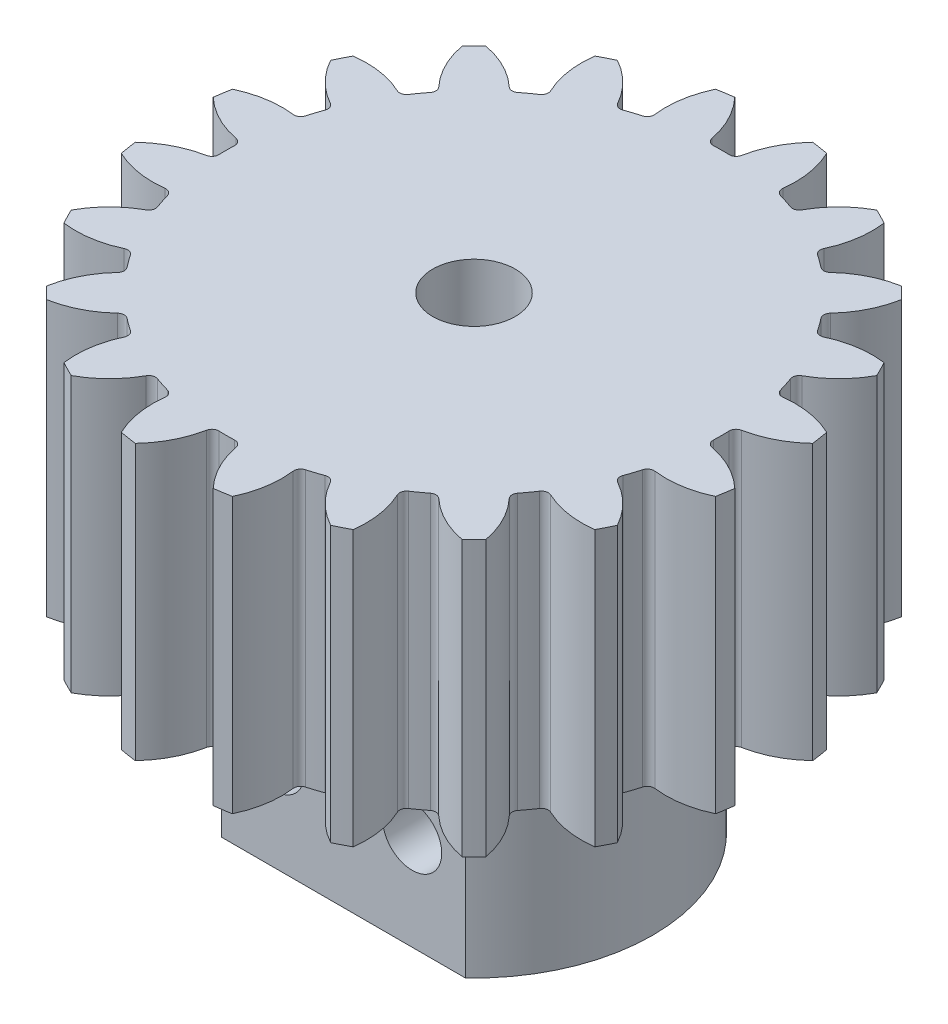
from build123d import *

# Parameters (mm, degrees)
SKETCH_1_R               = 22
EXTRUDE_1_DEPTH          = 20
CUT_EXTRUDE_1_DEPTH      = 37.986484018
PATTERN_CIRCULAR_1_COUNT = 20
SKETCH_3_R               = 13
EXTRUDE_2_DEPTH          = 14
CUT_EXTRUDE_START        = 13
SKETCH_4_W               = 26
SKETCH_4_H               = 14
CUT_EXTRUDE_2_DEPTH      = 3.5
CUT_EXTRUDE_START_2      = -13
SKETCH_4_2_W             = 26
SKETCH_4_2_H             = 14
CUT_EXTRUDE_3_DEPTH      = 3.5
CUT_EXTRUDE_4_DEPTH      = 37.768157322
CUT_EXTRUDE_4_DEPTH_BACK = 37.768157322
SKETCH_5_R               = 2.15
CUT_EXTRUDE_5_DEPTH      = 37.768157322
CUT_EXTRUDE_5_DEPTH_BACK = 37.768157322
SKETCH_6_R               = 3


with BuildPart() as part:
    # 草图1 → 凸台-拉伸1 (new body)
    with BuildSketch(Plane(origin=(0, 0, 0), x_dir=(1, 0, 0), z_dir=(0, 1, 0))):
        Circle(SKETCH_1_R)
    extrude(amount=EXTRUDE_1_DEPTH)

    # 草图2 → 切除-拉伸1 (cut, through all)
    with BuildSketch(Plane(origin=(0, 0, 0), x_dir=(1, 0, 0), z_dir=(0, 1, 0))):
        with BuildLine():
            ThreePointArc((2.837481906, 21.81624845), (0, 22), (-2.837481906, 21.81624845))
            ThreePointArc((-2.837481906, 21.81624845), (-1.711811819, 20.232483958), (-1.076870853, 18.396103529))
            ThreePointArc((-1.076870853, 18.396103529), (-0.898107392, 18.100169503), (-0.570069425, 17.990970537))
            ThreePointArc((-0.570069425, 17.990970537), (0, 18), (0.570069425, 17.990970537))
            ThreePointArc((0.570069425, 17.990970537), (0.898107392, 18.100169503), (1.076870853, 18.396103529))
            ThreePointArc((1.076870853, 18.396103529), (1.711811819, 20.232483958), (2.837481906, 21.81624845))
        make_face()
    cut_extrude_1 = extrude(amount=CUT_EXTRUDE_1_DEPTH, mode=Mode.SUBTRACT)

    # 阵列(圆周)1: 切除-拉伸1 ×20 about axis
    pattern_circular_1_axis = Axis((0, 20, 0), (0, 1, 0))
    for i in range(1, PATTERN_CIRCULAR_1_COUNT):
        add(cut_extrude_1.rotate(pattern_circular_1_axis, i * 360 / PATTERN_CIRCULAR_1_COUNT), mode=Mode.SUBTRACT)

    # 草图3 → 凸台-拉伸2 (add)
    with BuildSketch(Plane(origin=(0, 0, 0), x_dir=(1, 0, 0), z_dir=(0, 1, 0))):
        Circle(SKETCH_3_R)
    extrude(amount=-EXTRUDE_2_DEPTH)

    # 草图4 → 切除-拉伸2 (cut)
    with BuildSketch(Plane.XY.offset(CUT_EXTRUDE_START)):
        with Locations((0, -7)):
            Rectangle(SKETCH_4_W, SKETCH_4_H)
    extrude(amount=-CUT_EXTRUDE_2_DEPTH, mode=Mode.SUBTRACT)

    # 草图4<2> → 切除-拉伸3 (cut)
    with BuildSketch(Plane.XY.offset(CUT_EXTRUDE_START_2)):
        with Locations((0, -7)):
            Rectangle(SKETCH_4_2_W, SKETCH_4_2_H)
    extrude(amount=CUT_EXTRUDE_3_DEPTH, mode=Mode.SUBTRACT)

    # 草图5 → 切除-拉伸4 (cut, two sides: drawn at the far end of the back side and taken through both)
    with BuildSketch(Plane.XY.offset(-CUT_EXTRUDE_4_DEPTH_BACK)):
        with Locations((5, -7)):
            Circle(SKETCH_5_R)
        with Locations((-5, -7)):
            Circle(SKETCH_5_R)
    extrude(amount=CUT_EXTRUDE_4_DEPTH + CUT_EXTRUDE_4_DEPTH_BACK, mode=Mode.SUBTRACT)

    # 草图6 → 切除-拉伸5 (cut, two sides: drawn at the far end of the back side and taken through both)
    with BuildSketch(Plane(origin=(0, 0, 0), x_dir=(1, 0, 0), z_dir=(0, 1, 0)).offset(-CUT_EXTRUDE_5_DEPTH_BACK)):
        Circle(SKETCH_6_R)
    extrude(amount=CUT_EXTRUDE_5_DEPTH + CUT_EXTRUDE_5_DEPTH_BACK, mode=Mode.SUBTRACT)


solid = part.part
